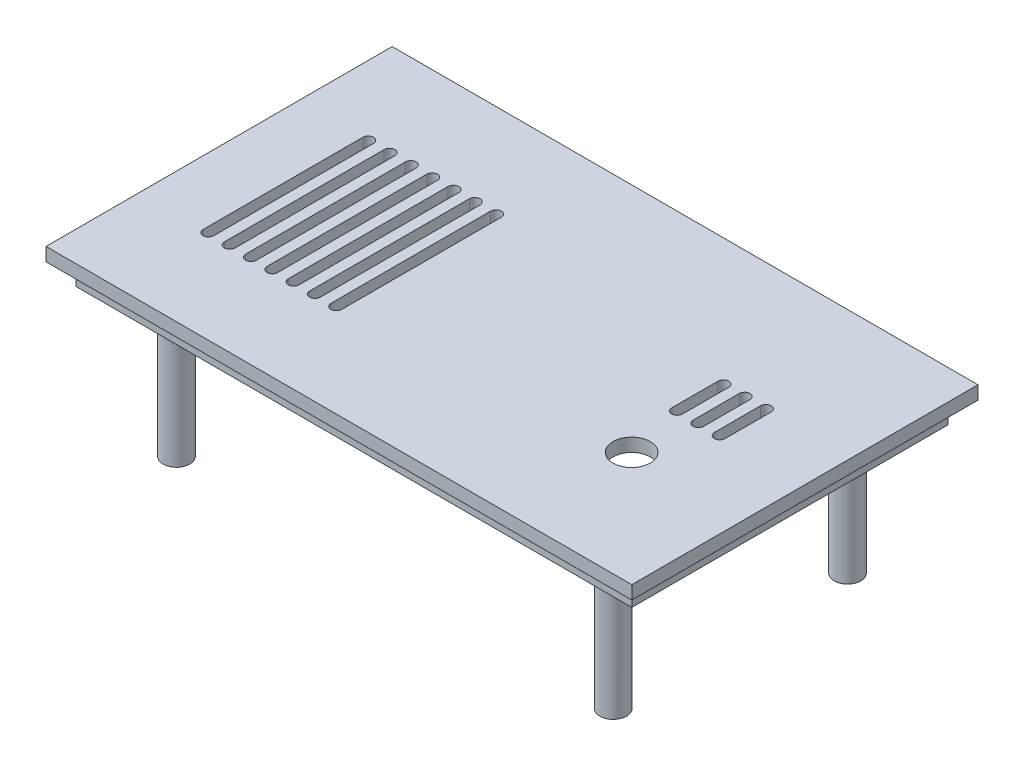
from build123d import *

# Parameters (mm, degrees)
CROQUIS_TAPA_W                    = 110
CROQUIS_TAPA_H                    = 65
TAPA_DEPTH                        = 2.5
CROQUIS_PESTANA_W                 = 104.4
CROQUIS_PESTANA_H                 = 59.4
PESTANA_DEPTH                     = 4
CROQUIS_PESTANA_HUECO_W           = 101.4
CROQUIS_PESTANA_HUECO_H           = 56.4
PESTANA_HUECO_DEPTH               = 4
CROQUIS_POSTES_R                  = 2.5
POSTES_PCB_DEPTH                  = 29.9
VENTANA_LDR_Y_VENTILAS_DEPTH      = 71.535522965
VENTANA_LDR_Y_VENTILAS_DEPTH_BACK = 71.535522965
CROQUIS_VENTANA_Y_VENTILAS_R      = 3.5


with BuildPart() as part:
    # Croquis_tapa → Tapa (new body)
    with BuildSketch(Plane(origin=(0, 0, 0), x_dir=(1, 0, 0), z_dir=(0, 1, 0))):
        Rectangle(CROQUIS_TAPA_W, CROQUIS_TAPA_H)
    extrude(amount=TAPA_DEPTH)

    # Croquis_pestana → Pestana (add)
    with BuildSketch(Plane(origin=(0, 0, 0), x_dir=(1, 0, 0), z_dir=(0, 1, 0))):
        Rectangle(CROQUIS_PESTANA_W, CROQUIS_PESTANA_H)
    extrude(amount=-PESTANA_DEPTH)

    # Croquis_pestana_hueco → Pestana_hueco (cut)
    with BuildSketch(Plane(origin=(0, 0, 0), x_dir=(1, 0, 0), z_dir=(0, 1, 0))):
        Rectangle(CROQUIS_PESTANA_HUECO_W, CROQUIS_PESTANA_HUECO_H)
    extrude(amount=-PESTANA_HUECO_DEPTH, mode=Mode.SUBTRACT)

    # Croquis_postes → Postes_PCB (add)
    with BuildSketch(Plane(origin=(0, 0, 0), x_dir=(1, 0, 0), z_dir=(0, 1, 0))):
        with Locations(Location((-41, 22, 0), (0, 0, 270))):
            Circle(CROQUIS_POSTES_R)
        with Locations(Location((-41, -22, 0), (0, 0, 270))):
            Circle(CROQUIS_POSTES_R)
        with Locations(Location((41, 22, 0), (0, 0, 270))):
            Circle(CROQUIS_POSTES_R)
        with Locations(Location((41, -22, 0), (0, 0, 270))):
            Circle(CROQUIS_POSTES_R)
    extrude(amount=-POSTES_PCB_DEPTH)

    # Croquis_ventana_y_ventilas → Ventana_LDR_y_ventilas (cut, two sides: drawn at the far end of the back side and taken through both)
    with BuildSketch(Plane(origin=(0, 0, 0), x_dir=(1, 0, 0), z_dir=(0, 1, 0)).offset(-VENTANA_LDR_Y_VENTILAS_DEPTH_BACK)):
        with Locations(Location((33.46, -11, 0), (0, 0, 90))):
            Circle(CROQUIS_VENTANA_Y_VENTILAS_R)
        with BuildLine():
            Line((30, 0), (30, 8.68))
            ThreePointArc((30, 8.68), (31, 9.68), (32, 8.68))
            Line((32, 8.68), (32, 0))
            ThreePointArc((32, 0), (31, -1), (30, 0))
        make_face()
        with BuildLine():
            Line((34, 0), (34, 8.68))
            ThreePointArc((34, 8.68), (35, 9.68), (36, 8.68))
            Line((36, 8.68), (36, 0))
            ThreePointArc((36, 0), (35, -1), (34, 0))
        make_face()
        with BuildLine():
            Line((38, 0), (38, 8.68))
            ThreePointArc((38, 8.68), (39, 9.68), (40, 8.68))
            Line((40, 8.68), (40, 0))
            ThreePointArc((40, 0), (39, -1), (38, 0))
        make_face()
        with BuildLine():
            Line((-19, -15), (-19, 15))
            ThreePointArc((-19, 15), (-18, 16), (-17, 15))
            Line((-17, 15), (-17, -15))
            ThreePointArc((-17, -15), (-18, -16), (-19, -15))
        make_face()
        with BuildLine():
            Line((-23, -15), (-23, 15))
            ThreePointArc((-23, 15), (-22, 16), (-21, 15))
            Line((-21, 15), (-21, -15))
            ThreePointArc((-21, -15), (-22, -16), (-23, -15))
        make_face()
        with BuildLine():
            Line((-27, -15), (-27, 15))
            ThreePointArc((-27, 15), (-26, 16), (-25, 15))
            Line((-25, 15), (-25, -15))
            ThreePointArc((-25, -15), (-26, -16), (-27, -15))
        make_face()
        with BuildLine():
            Line((-31, -15), (-31, 15))
            ThreePointArc((-31, 15), (-30, 16), (-29, 15))
            Line((-29, 15), (-29, -15))
            ThreePointArc((-29, -15), (-30, -16), (-31, -15))
        make_face()
        with BuildLine():
            Line((-35, -15), (-35, 15))
            ThreePointArc((-35, 15), (-34, 16), (-33, 15))
            Line((-33, 15), (-33, -15))
            ThreePointArc((-33, -15), (-34, -16), (-35, -15))
        make_face()
        with BuildLine():
            Line((-39, -15), (-39, 15))
            ThreePointArc((-39, 15), (-38, 16), (-37, 15))
            Line((-37, 15), (-37, -15))
            ThreePointArc((-37, -15), (-38, -16), (-39, -15))
        make_face()
        with BuildLine():
            Line((-43, -15), (-43, 15))
            ThreePointArc((-43, 15), (-42, 16), (-41, 15))
            Line((-41, 15), (-41, -15))
            ThreePointArc((-41, -15), (-42, -16), (-43, -15))
        make_face()
    extrude(amount=VENTANA_LDR_Y_VENTILAS_DEPTH + VENTANA_LDR_Y_VENTILAS_DEPTH_BACK, mode=Mode.SUBTRACT)


solid = part.part
